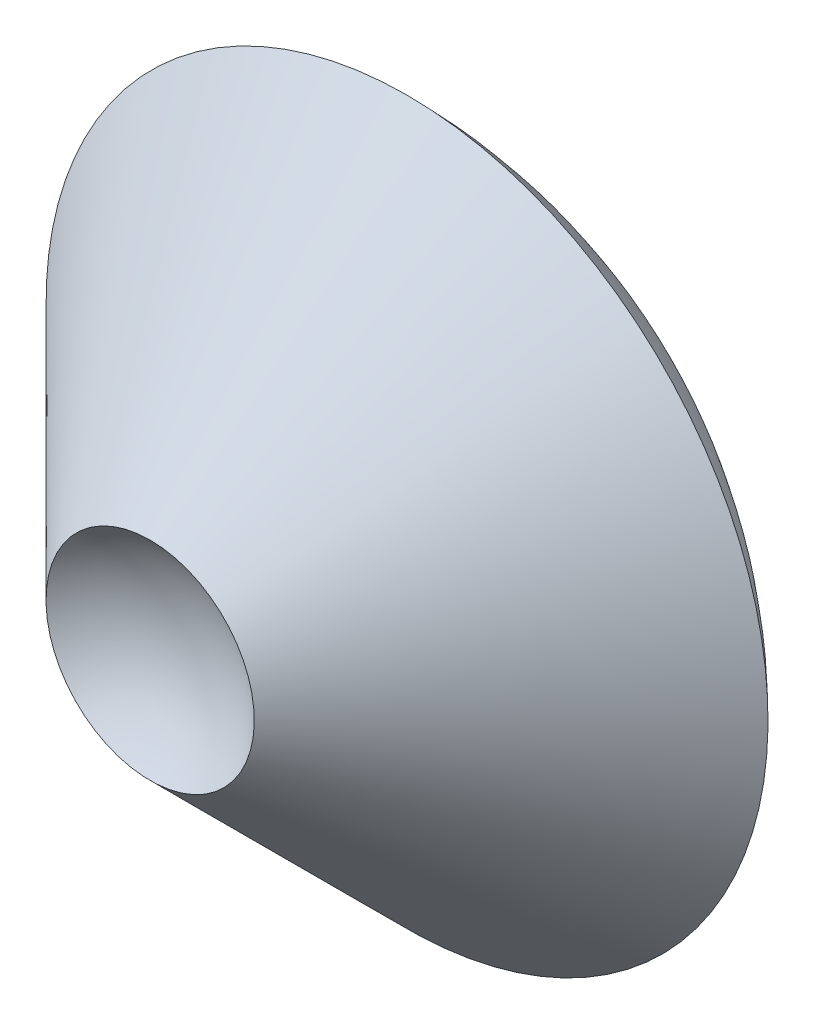
from build123d import *


with BuildPart() as part:
    # Lens Sketch → Lens Revolution (revolve)
    with BuildSketch(Plane(origin=(0, 0, 0), x_dir=(0, 0, -1), z_dir=(1, 0, 0))):
        with BuildLine():
            Line((183.847763109, 183.847763109), (53.033008589, 53.033008589))
            ThreePointArc((53.033008589, 53.033008589), (69.290964938, 28.701257427), (75, 0))
            Line((75, 0), (260, 0))
            ThreePointArc((260, 0), (240.208678453, 99.497692415), (183.847763109, 183.847763109))
        make_face()
    revolve(axis=Axis((0, 0, -75), (0, 0, 1)))


solid = part.part
